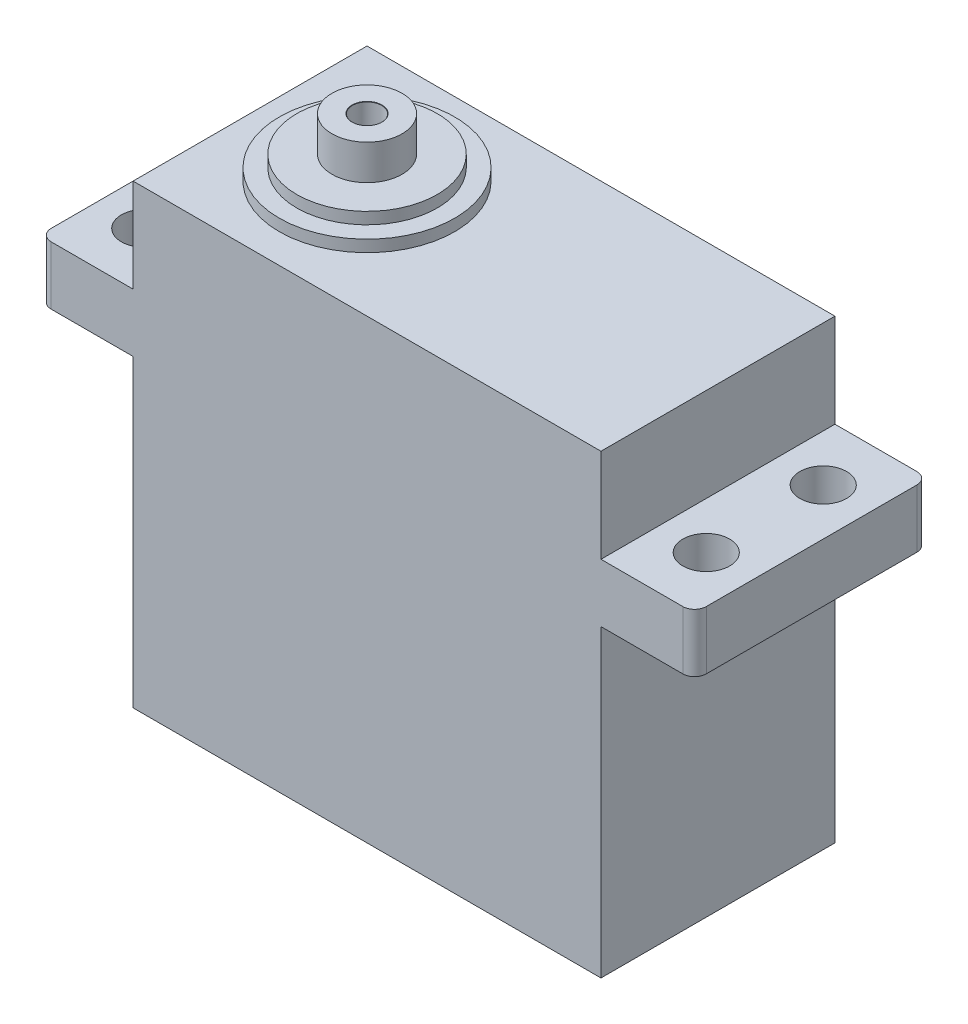
from build123d import *

# Parameters (mm, degrees)
EXTRUDE_1_DEPTH              = 20
SKETCH_2_R                   = 2
CUT_EXTRUDE_1_DEPTH          = 20
SKETCH_2_3_R                 = 2
CUT_EXTRUDE_2_DEPTH          = 20
SKETCH_2_4_R                 = 7.5
EXTRUDE_2_DEPTH              = 1
SKETCH_2_5_R                 = 6
EXTRUDE_3_DEPTH              = 2
SKETCH_2_6_R                 = 3
EXTRUDE_4_DEPTH              = 5
HOLE_WIZARD_M3_2_D           = 2.5
HOLE_WIZARD_M3_2_DEPTH       = 2
HOLE_WIZARD_M3_2_CSINK_D     = 2.55
HOLE_WIZARD_M3_2_CSINK_ANGLE = 90
FILLET_1_R                   = 1
FILLET_2_R                   = 1


with BuildPart() as part:
    # 草图1 → 凸台-拉伸1 (new body)
    with BuildSketch(Plane.XY):
        Polygon((40, 39), (0, 39), (0, 31), (-8, 31), (-8, 26.015576324), (0, 26.015576324), (0, 0), (40, 0), (40, 26.015576324), (48, 26.015576324), (48, 31), (40, 31), align=None)
    extrude(amount=EXTRUDE_1_DEPTH)

    # 草图2 → 切除-拉伸1 (cut)
    with BuildSketch(Plane(origin=(0, 39, 0), x_dir=(1, 0, 0), z_dir=(0, 1, 0))):
        with Locations((-4, -15)):
            Circle(SKETCH_2_R)
    extrude(amount=-CUT_EXTRUDE_1_DEPTH, mode=Mode.SUBTRACT)

    # 草图2<3> → 切除-拉伸2 (cut)
    with BuildSketch(Plane(origin=(0, 39, 0), x_dir=(1, 0, 0), z_dir=(0, 1, 0))):
        with Locations((-4, -5)):
            Circle(SKETCH_2_3_R)
        with Locations((44, -5)):
            Circle(SKETCH_2_3_R)
        with Locations((44, -15)):
            Circle(SKETCH_2_3_R)
    extrude(amount=-CUT_EXTRUDE_2_DEPTH, mode=Mode.SUBTRACT)

    # 草图2<4> → 凸台-拉伸2 (add)
    with BuildSketch(Plane(origin=(0, 39, 0), x_dir=(1, 0, 0), z_dir=(0, 1, 0))):
        with Locations((10, -10)):
            Circle(SKETCH_2_4_R)
    extrude(amount=EXTRUDE_2_DEPTH)

    # 草图2<5> → 凸台-拉伸3 (add)
    with BuildSketch(Plane(origin=(0, 39, 0), x_dir=(1, 0, 0), z_dir=(0, 1, 0))):
        with Locations((10, -10)):
            Circle(SKETCH_2_5_R)
    extrude(amount=EXTRUDE_3_DEPTH)

    # 草图2<6> → 凸台-拉伸4 (add)
    with BuildSketch(Plane(origin=(0, 39, 0), x_dir=(1, 0, 0), z_dir=(0, 1, 0))):
        with Locations((10, -10)):
            Circle(SKETCH_2_6_R)
    extrude(amount=EXTRUDE_4_DEPTH)

    # M3 螺纹孔的螺纹孔钻头2
    with Locations(Plane(origin=(10, 44, 10), x_dir=(0, 0, 1), z_dir=(0, 1, 0))):
        with Locations((0, 0)):
            CounterSinkHole(HOLE_WIZARD_M3_2_D / 2, HOLE_WIZARD_M3_2_CSINK_D / 2, depth=HOLE_WIZARD_M3_2_DEPTH, counter_sink_angle=HOLE_WIZARD_M3_2_CSINK_ANGLE)

    # 圆角1
    fillet_1_edges = [part.edges().sort_by_distance(p)[0] for p in [
        (-8, 28.507788162, 20),
    ]]
    fillet(fillet_1_edges, radius=FILLET_1_R)

    # 圆角2
    fillet_2_edges = [part.edges().sort_by_distance(p)[0] for p in [
        (-8, 28.507788162, 0),
        (48, 28.507788162, 0),
        (48, 28.507788162, 20),
    ]]
    fillet(fillet_2_edges, radius=FILLET_2_R)


solid = part.part
